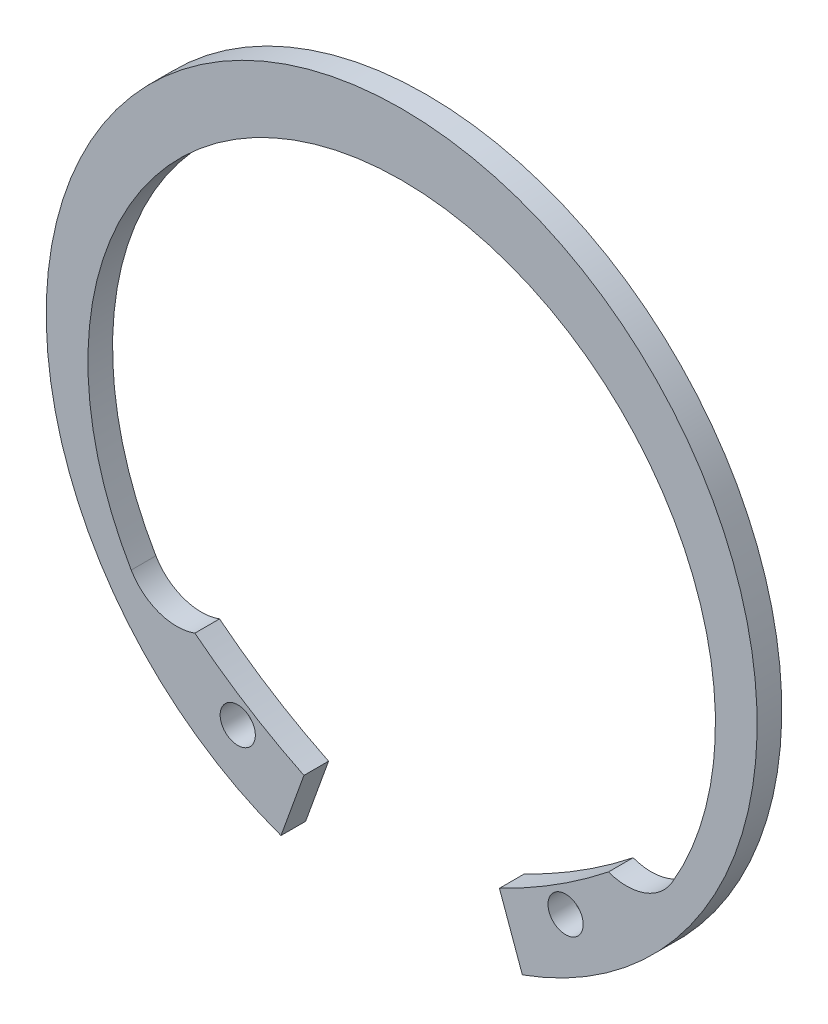
from build123d import *

# Parameters (mm, degrees)
BOSS_EXTRUDE1_DEPTH      = 0.875
BOSS_EXTRUDE1_DEPTH_BACK = 0.875
SKETCH3_R                = 1.25
CUT_EXTRUDE2_DEPTH       = 36.71961121


with BuildPart() as part:
    # Sketch3 → Boss-Extrude1 (new, two sides: drawn at the far end of the back side and taken through both)
    with BuildSketch(Plane.XY.offset(-BOSS_EXTRUDE1_DEPTH_BACK)):
        with BuildLine():
            Line((-8.572944297, -23.750097391), (-6.943236074, -19.235227392))
            Line((-6.943236074, -19.235227392), (-14.689323253, -14.357081274))
            ThreePointArc((-14.689323253, -14.357081274), (-17.243755895, -14.366044793), (-19.211282174, -12.736920241))
            ThreePointArc((-19.211282174, -12.736920241), (0, 20.85), (19.211282174, -12.736920241))
            ThreePointArc((19.211282174, -12.736920241), (17.243755895, -14.366044793), (14.689323253, -14.357081274))
            Line((14.689323253, -14.357081274), (6.943236074, -19.235227392))
            Line((6.943236074, -19.235227392), (8.572944297, -23.750097391))
            ThreePointArc((8.572944297, -23.750097391), (0, 25.25), (-8.572944297, -23.750097391))
        make_face()
        with Locations((-11.644462168, -18.490429957)):
            Circle(SKETCH3_R, mode=Mode.SUBTRACT)
        with Locations(Location((11.644462168, -18.490429957, 0), (0, 0, 180))):
            Circle(SKETCH3_R, mode=Mode.SUBTRACT)
    extrude(amount=BOSS_EXTRUDE1_DEPTH + BOSS_EXTRUDE1_DEPTH_BACK)

    # Sketch5 → Cut-Extrude2 (cut, symmetric)
    with BuildSketch(Plane.XY):
        with BuildLine():
            Line((-14.689323253, -14.357081274), (0, 0))
            Line((0, 0), (-6.943236074, -19.235227392))
            ThreePointArc((-6.943236074, -19.235227392), (-10.949502149, -17.007700474), (-14.689323253, -14.357081274))
        make_face()
    cut_extrude2 = extrude(amount=CUT_EXTRUDE2_DEPTH, both=True, mode=Mode.SUBTRACT)

    # Mirror1: Cut-Extrude2 across plane
    add(cut_extrude2.mirror(Plane(origin=(0, 0, 0), x_dir=(0, 0, 1), z_dir=(1, 0, 0))), mode=Mode.SUBTRACT)


solid = part.part
